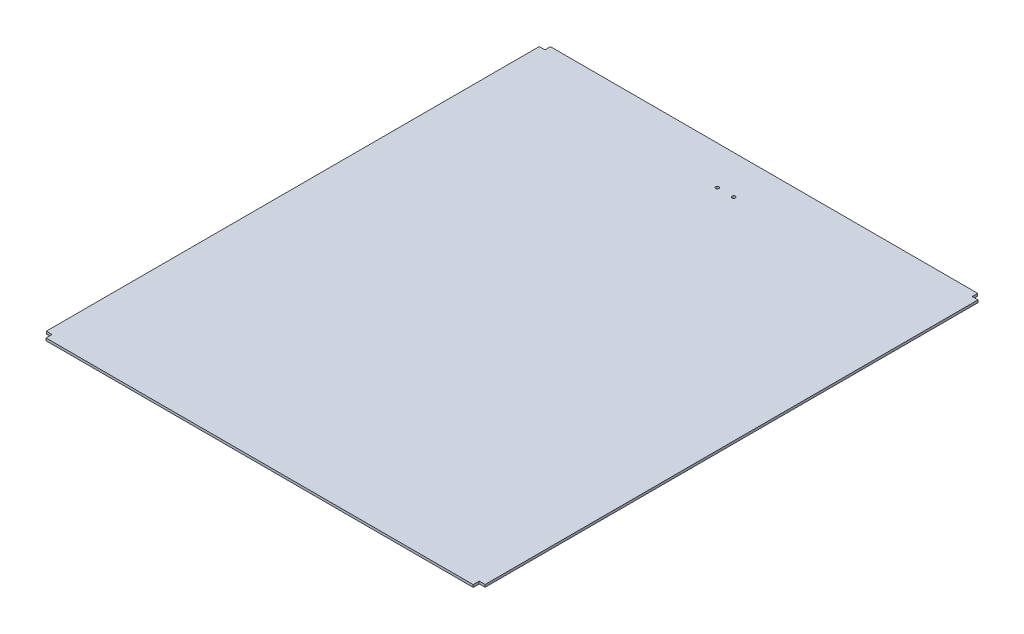
from build123d import *

# Parameters (mm, degrees)
SKETCH1_W           = 534
SKETCH1_H           = 600
BOSS_EXTRUDE1_DEPTH = 3
SKETCH3_W           = 520
SKETCH3_H           = 614
BOSS_EXTRUDE2_DEPTH = 3
SKETCH4_R           = 2
CUT_EXTRUDE2_DEPTH  = 10


with BuildPart() as part:
    # Sketch1 → Boss-Extrude1 (new body)
    with BuildSketch(Plane(origin=(0, 0, 0), x_dir=(1, 0, 0), z_dir=(0, 1, 0))):
        with Locations((267.046520854, 300.291126183)):
            Rectangle(SKETCH1_W, SKETCH1_H)
    extrude(amount=BOSS_EXTRUDE1_DEPTH)

    # Sketch3 → Boss-Extrude2 (add)
    with BuildSketch(Plane(origin=(0, 0, 0), x_dir=(1, 0, 0), z_dir=(0, 1, 0))):
        with Locations((267, 300)):
            Rectangle(SKETCH3_W, SKETCH3_H)
    extrude(amount=BOSS_EXTRUDE2_DEPTH)

    # Sketch4 → Cut-Extrude2 (cut)
    with BuildSketch(Plane(origin=(0, 3, 0), x_dir=(1, 0, 0), z_dir=(0, 1, 0))):
        with Locations(Location((257.025, 560, 0), (0, 0, 270))):
            Circle(SKETCH4_R)
        with Locations(Location((277.025, 560, 0), (0, 0, 270))):
            Circle(SKETCH4_R)
    extrude(amount=-CUT_EXTRUDE2_DEPTH, mode=Mode.SUBTRACT)


solid = part.part
